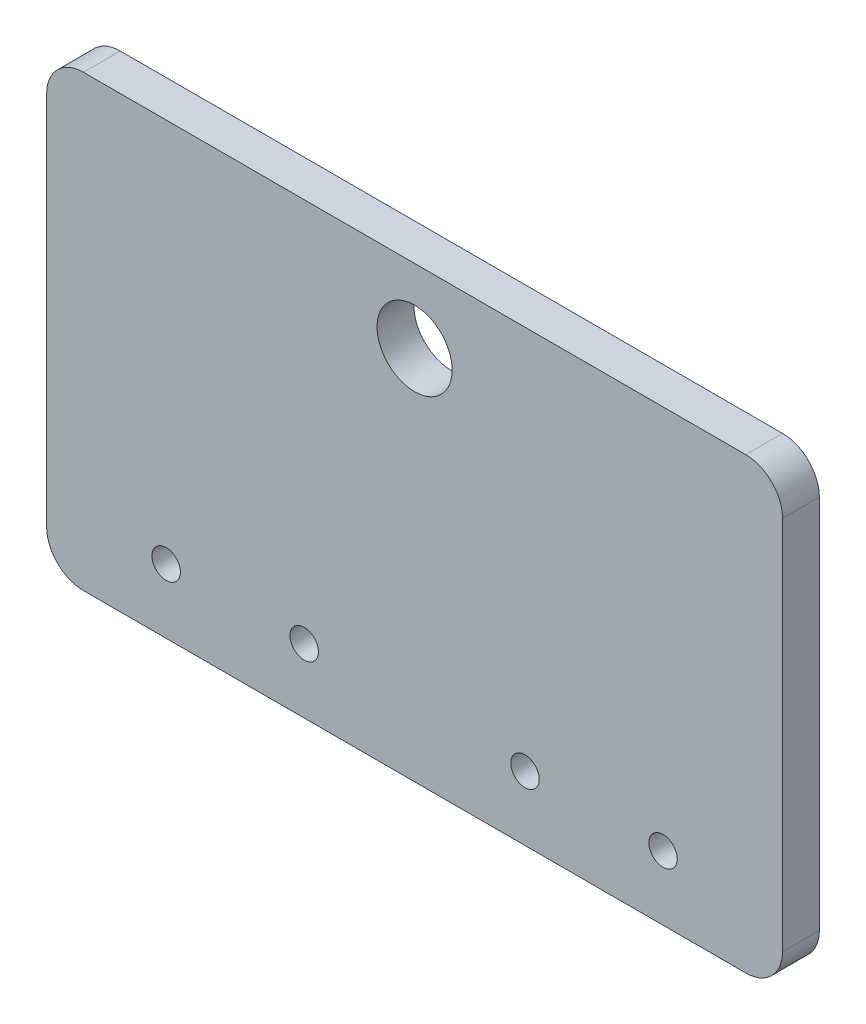
from build123d import *

# Parameters (mm, degrees)
SKETCH1_W             = 127
SKETCH1_H             = 77.47
BOSS_EXTRUDE1_DEPTH   = 6.35
F_8_CLEARANCE_HOLE1_D = 4.9149
FILLET1_R             = 6.35
SKETCH8_R             = 6.477
CUT_EXTRUDE1_DEPTH    = 149.899037606


with BuildPart() as part:
    # Sketch1 → Boss-Extrude1 (new body)
    with BuildSketch(Plane.XY):
        with Locations((63.5, 38.735)):
            Rectangle(SKETCH1_W, SKETCH1_H)
    extrude(amount=BOSS_EXTRUDE1_DEPTH)

    # #8 Clearance Hole1 (through all)
    with Locations(Plane.XY.offset(6.35)):
        with Locations((20.6248, 11.1125), (44.45, 11.1125), (82.55, 11.1125), (106.3752, 11.1125)):
            Hole(F_8_CLEARANCE_HOLE1_D / 2)

    # Fillet1
    fillet1_edges = [part.edges().sort_by_distance(p)[0] for p in [
        (0, 77.47, 3.175),
        (127, 77.47, 3.175),
        (127, 0, 3.175),
        (0, 0, 3.175),
    ]]
    fillet(fillet1_edges, radius=FILLET1_R)

    # Sketch8 → Cut-Extrude1 (cut, through all)
    with BuildSketch(Plane.XY.offset(6.35)):
        with Locations((63.5, 64.77)):
            Circle(SKETCH8_R)
    extrude(amount=-CUT_EXTRUDE1_DEPTH, mode=Mode.SUBTRACT)


solid = part.part
